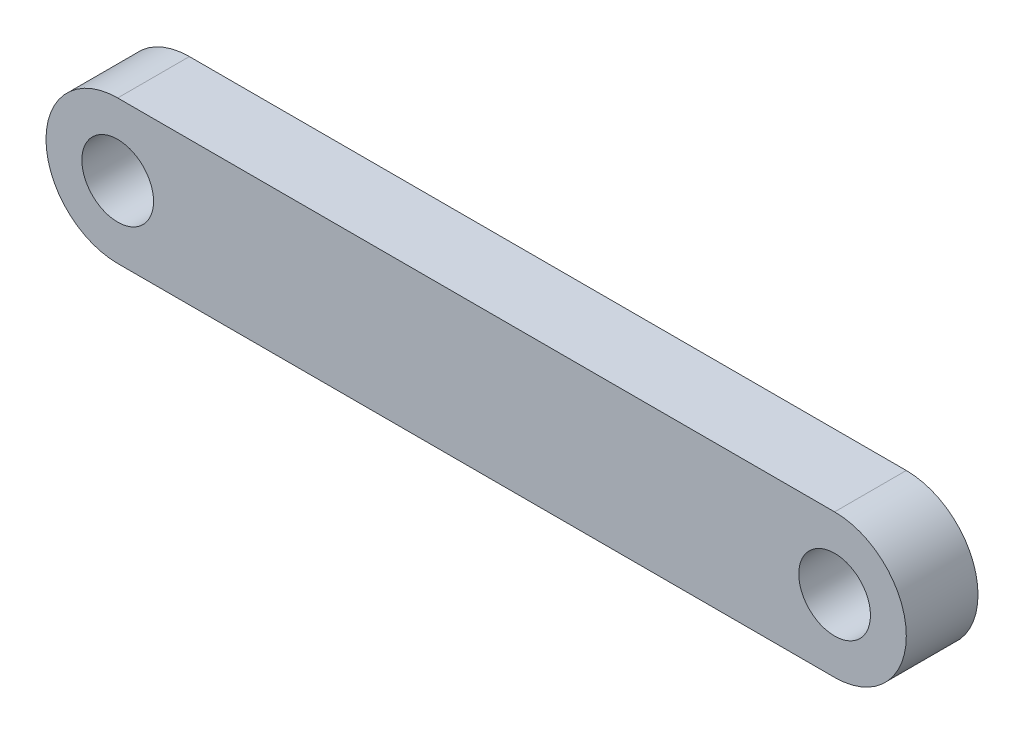
from build123d import *

# Parameters (mm, degrees)
EXTRUDE_1_DEPTH = 10


with BuildPart() as part:
    # ｽｹｯﾁ2 → ﾎﾞｽ - 押し出し1 (new body)
    with BuildSketch(Plane.XY):
        with BuildLine():
            ThreePointArc((-50, 10), (-60, 0), (-50, -10))
            Line((-50, -10), (-50, -5))
            ThreePointArc((-50, -5), (-55, 0), (-50, 5))
            Line((-50, 5), (-50, 10))
        make_face()
        with BuildLine():
            Line((-50, -5), (-50, -10))
            ThreePointArc((-50, -10), (-42.928932188, -7.071067812), (-40, 0))
            ThreePointArc((-40, 0), (-42.928932188, 7.071067812), (-50, 10))
            Line((-50, 10), (-50, 5))
            ThreePointArc((-50, 5), (-46.464466094, 3.535533906), (-45, 0))
            ThreePointArc((-45, 0), (-46.464466094, -3.535533906), (-50, -5))
        make_face()
        with BuildLine():
            ThreePointArc((-40, 0), (-42.928932188, -7.071067812), (-50, -10))
            Line((-50, -10), (50, -10))
            ThreePointArc((50, -10), (40, 0), (50, 10))
            Line((50, 10), (-50, 10))
            ThreePointArc((-50, 10), (-42.928932188, 7.071067812), (-40, 0))
        make_face()
        with BuildLine():
            ThreePointArc((50, 10), (40, 0), (50, -10))
            Line((50, -10), (50, -5))
            ThreePointArc((50, -5), (45, 0), (50, 5))
            Line((50, 5), (50, 10))
        make_face()
        with BuildLine():
            Line((50, -5), (50, -10))
            ThreePointArc((50, -10), (57.071067812, -7.071067812), (60, 0))
            ThreePointArc((60, 0), (57.071067812, 7.071067812), (50, 10))
            Line((50, 10), (50, 5))
            ThreePointArc((50, 5), (53.535533906, 3.535533906), (55, 0))
            ThreePointArc((55, 0), (53.535533906, -3.535533906), (50, -5))
        make_face()
    extrude(amount=EXTRUDE_1_DEPTH)


solid = part.part
